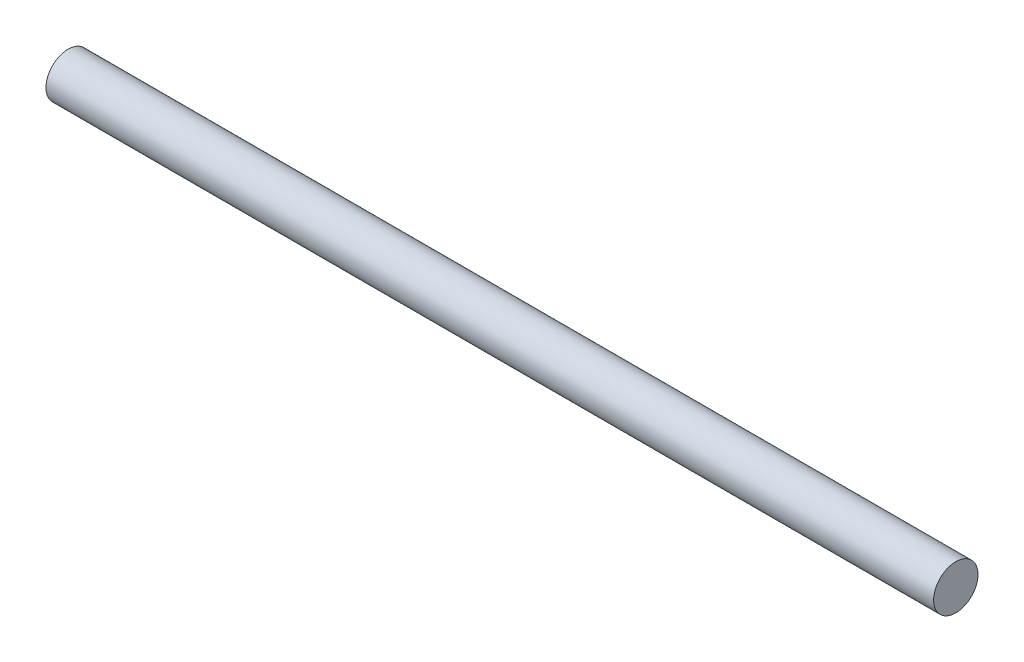
from build123d import *

# Parameters (mm, degrees)
SKETCH1_R           = 12.7
BOSS_EXTRUDE1_DEPTH = 508


with BuildPart() as part:
    # Sketch1 → Boss-Extrude1 (new body)
    with BuildSketch(Plane(origin=(0, 0, 0), x_dir=(0, 0, -1), z_dir=(1, 0, 0))):
        Circle(SKETCH1_R)
    extrude(amount=BOSS_EXTRUDE1_DEPTH)


solid = part.part
